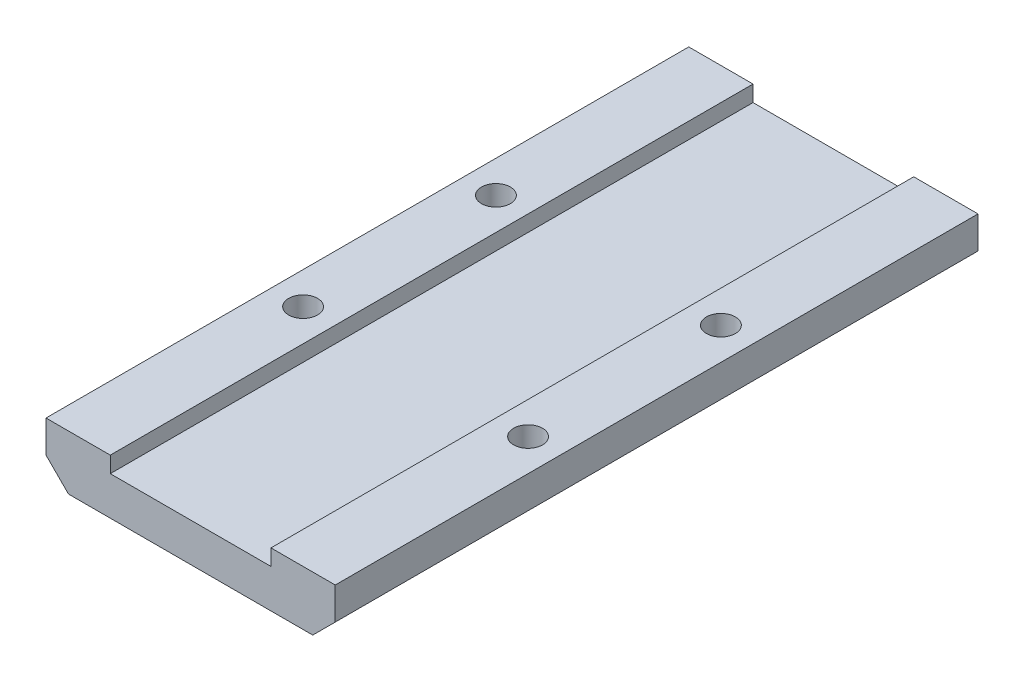
from build123d import *

# Parameters (mm, degrees)
EXTRUDE_1_DEPTH             = 200
CUT_EXTRUDE_1_REACH         = 207.704
SKETCH_2_R                  = 4.5
PATTERN_LINEAR_1_COUNT      = 2
PATTERN_LINEAR_1_PITCH      = 60
PATTERN_LINEAR_1_COUNT_DIR2 = 2
PATTERN_LINEAR_1_PITCH_DIR2 = 70


with BuildPart() as part:
    # 草图1 → 凸台-拉伸1 (new body)
    with BuildSketch(Plane.XY):
        Polygon((38, 0), (-38, 0), (-45, 7), (-45, 17), (-25, 17), (-25, 12), (25, 12), (25, 17), (45, 17), (45, 7), align=None)
    extrude(amount=EXTRUDE_1_DEPTH)

    # 草图2 → 切除-拉伸1 (cut, up to next)
    with BuildSketch(Plane(origin=(0, 17, 0), x_dir=(1, 0, 0), z_dir=(0, 1, 0)), mode=Mode.PRIVATE) as cut_extrude_1_sk1:
        with Locations(Location((-35, -130, 0), (0, 0, 270))):
            Circle(SKETCH_2_R)
    cut_extrude_1_tool1 = extrude(cut_extrude_1_sk1.sketch, amount=-CUT_EXTRUDE_1_REACH, mode=Mode.PRIVATE) & part.part
    cut_extrude_1 = cut_extrude_1_tool1.solids().sort_by_distance((-35, 17, 130))[0]
    add(cut_extrude_1, mode=Mode.SUBTRACT)

    # 阵列(线性)1: 切除-拉伸1; each copy of 切除-拉伸1 runs up to whatever stops it at its own place
    pattern_linear_1_before = part.part  # the part as the pattern finds it: every copy runs up to it
    pattern_linear_1_cut_extrude_1_long = extrude(cut_extrude_1_sk1.sketch, amount=-CUT_EXTRUDE_1_REACH, mode=Mode.PRIVATE)
    pattern_linear_1_cut_extrude_1_tool1 = pattern_linear_1_cut_extrude_1_long.moved(Location(Vector(0, 0, -1) * (0 * PATTERN_LINEAR_1_PITCH) + Vector(1, 0, 0) * (1 * PATTERN_LINEAR_1_PITCH_DIR2))) & pattern_linear_1_before
    add(pattern_linear_1_cut_extrude_1_tool1.solids().sort_by_distance((35, 17, 130))[0], mode=Mode.SUBTRACT)
    pattern_linear_1_cut_extrude_1_tool2 = pattern_linear_1_cut_extrude_1_long.moved(Location(Vector(0, 0, -1) * (1 * PATTERN_LINEAR_1_PITCH) + Vector(1, 0, 0) * (0 * PATTERN_LINEAR_1_PITCH_DIR2))) & pattern_linear_1_before
    add(pattern_linear_1_cut_extrude_1_tool2.solids().sort_by_distance((-35, 17, 70))[0], mode=Mode.SUBTRACT)
    pattern_linear_1_cut_extrude_1_tool3 = pattern_linear_1_cut_extrude_1_long.moved(Location(Vector(0, 0, -1) * (1 * PATTERN_LINEAR_1_PITCH) + Vector(1, 0, 0) * (1 * PATTERN_LINEAR_1_PITCH_DIR2))) & pattern_linear_1_before
    add(pattern_linear_1_cut_extrude_1_tool3.solids().sort_by_distance((35, 17, 70))[0], mode=Mode.SUBTRACT)


solid = part.part
